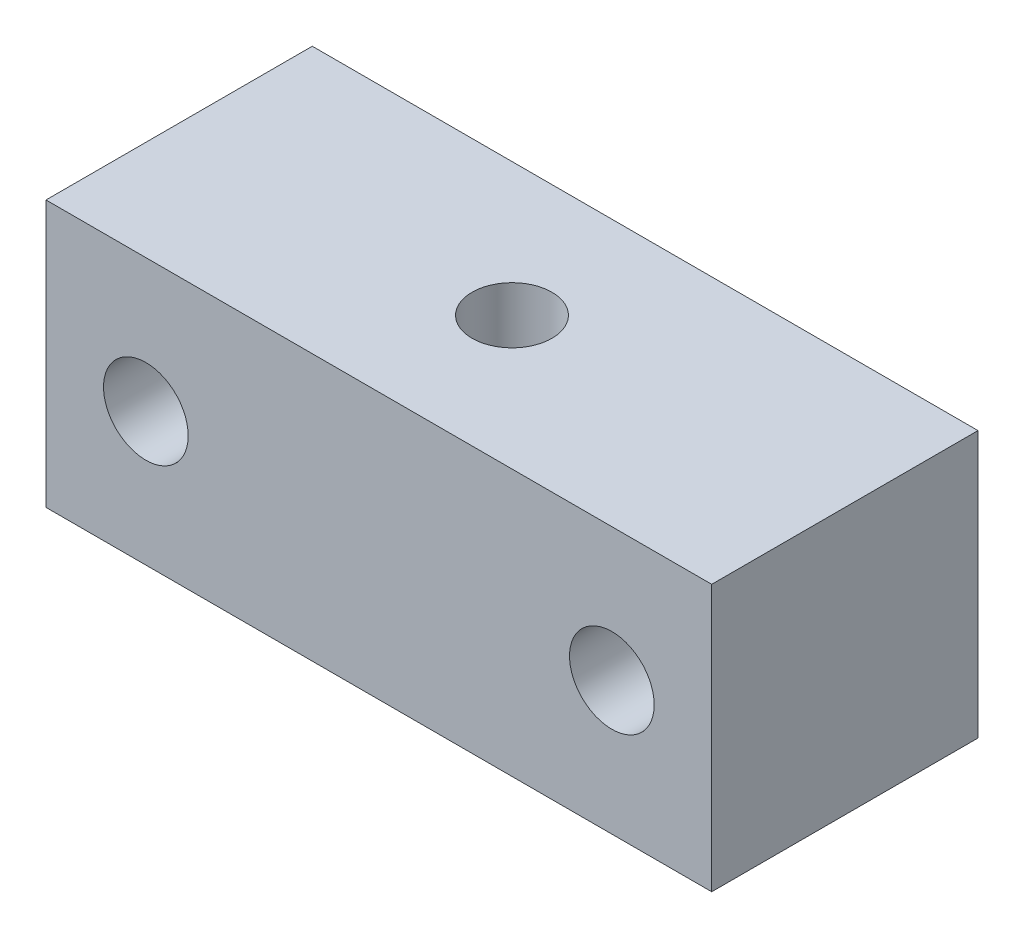
from build123d import *

# Parameters (mm, degrees)
SKETCH1_W           = 31.75
SKETCH1_H           = 12.7
BOSS_EXTRUDE1_DEPTH = 6.35
SKETCH2_R           = 2.0193
CUT_EXTRUDE1_DEPTH  = 37.477972806
SKETCH3_R           = 1.905
CUT_EXTRUDE2_DEPTH  = 35.780382402


with BuildPart() as part:
    # Sketch1 → Boss-Extrude1 (new, symmetric)
    with BuildSketch(Plane.XY):
        with Locations((15.875, 6.35)):
            Rectangle(SKETCH1_W, SKETCH1_H)
    extrude(amount=BOSS_EXTRUDE1_DEPTH, both=True)

    # Sketch2 → Cut-Extrude1 (cut, through all)
    with BuildSketch(Plane.XY.offset(6.35)):
        with Locations((4.7625, 6.35)):
            Circle(SKETCH2_R)
        with Locations((26.9875, 6.35)):
            Circle(SKETCH2_R)
    extrude(amount=-CUT_EXTRUDE1_DEPTH, mode=Mode.SUBTRACT)

    # Sketch3 → Cut-Extrude2 (cut, through all)
    with BuildSketch(Plane(origin=(0, 12.7, 0), x_dir=(1, 0, 0), z_dir=(0, 1, 0))):
        with Locations(Location((15.875, 0, 0), (0, 0, 270))):
            Circle(SKETCH3_R)
    extrude(amount=-CUT_EXTRUDE2_DEPTH, mode=Mode.SUBTRACT)


solid = part.part
